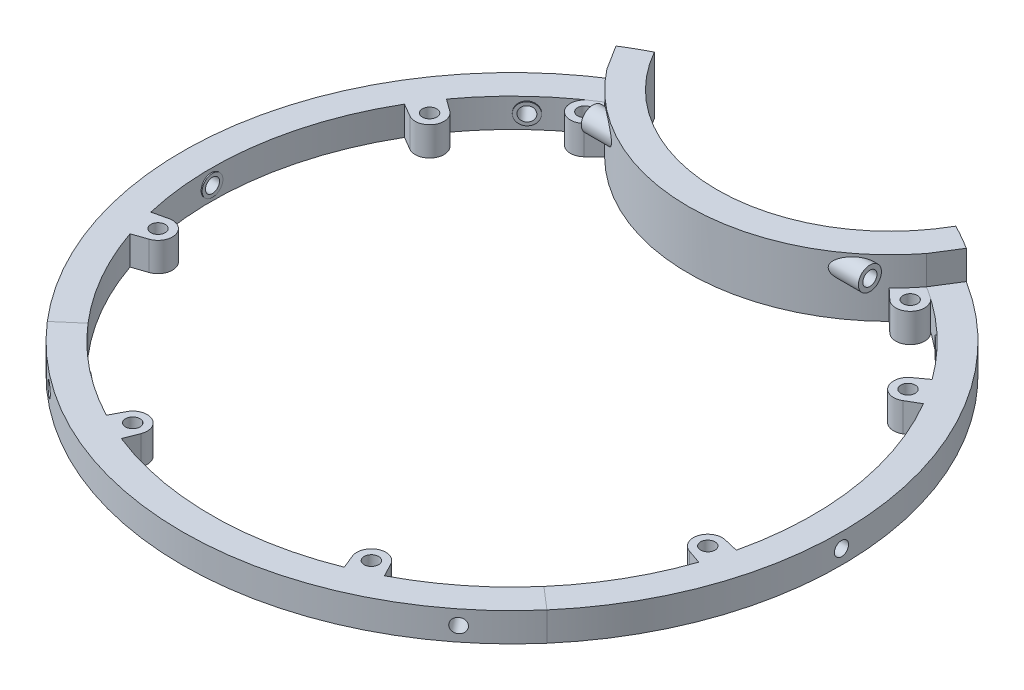
from build123d import *
from build123d.topology import SkipClean

# Parameters (mm, degrees)
BOSS_EXTRUDE1_DEPTH                 = 12.7
CUT_EXTRUDE2_REACH                  = 78.175
CUT_EXTRUDE2_END_RADIUS             = 44.45
SKETCH9_R                           = 1.55
BOSS_EXTRUDE3_START                 = -22.86
SKETCH9_3_R                         = 2.54
SKETCH9_3_R_2                       = 1.55
BOSS_EXTRUDE3_DEPTH                 = 7.62
BOSS_EXTRUDE4_DEPTH                 = 6.35
SKETCH10_R                          = 3.175
SKETCH10_R_2                        = 1.5875
BOSS_EXTRUDE5_DEPTH                 = 6.35
CIRPATTERN3_COUNT                   = 2
CIRPATTERN3_ANGLE                   = 98.596666667
CUT_EXTRUDE3_REACH                  = 159.445
CUT_EXTRUDE3_END_RADIUS             = 72.5
SKETCH12_R                          = 1.55
CUT_EXTRUDE3_DIRECTION_2_REACH      = 159.445
CUT_EXTRUDE3_DIRECTION_2_END_RADIUS = 66.15
SKETCH12_4_R                        = 2.286
SKETCH12_4_R_2                      = 1.55
BOSS_EXTRUDE6_DEPTH                 = 0.254
CUT_EXTRUDE4_REACH                  = 143.725
CUT_EXTRUDE4_END_RADIUS             = 72.5
SKETCH13_R                          = 1.55
CUT_EXTRUDE4_DIRECTION_2_REACH      = 143.725
CUT_EXTRUDE4_DIRECTION_2_END_RADIUS = 66.15
SKETCH13_6_R                        = 2.286
SKETCH13_6_R_2                      = 1.55
BOSS_EXTRUDE7_DEPTH                 = 0.254
CUT_EXTRUDE5_REACH                  = 153.381
CUT_EXTRUDE5_END_RADIUS             = 72.5
SKETCH14_R                          = 1.55
CUT_EXTRUDE5_DIRECTION_2_REACH      = 153.381
CUT_EXTRUDE5_DIRECTION_2_END_RADIUS = 66.15
SKETCH14_8_R                        = 2.286
SKETCH14_8_R_2                      = 1.55
BOSS_EXTRUDE8_DEPTH                 = 0.254
SKETCH15_R                          = 3.175
SKETCH15_R_2                        = 1.5875
BOSS_EXTRUDE9_DEPTH                 = 6.35


with BuildPart() as part:
    # Sketch1 → Boss-Extrude1 (new body)
    with BuildSketch(Plane(origin=(0, 0, 0), x_dir=(1, 0, 0), z_dir=(0, 1, 0))):
        with BuildLine():
            Line((35.15688403, 56.034061117), (38.531732308, 61.412992154))
            ThreePointArc((38.531732308, 61.412992154), (35.878756385, 62.999720954), (33.160552015, 64.471914738))
            ThreePointArc((33.160552015, 64.471914738), (0, 45.133252378), (-33.160552015, 64.471914738))
            ThreePointArc((-33.160552015, 64.471914738), (-35.878756385, 62.999720954), (-38.531732308, 61.412992154))
            Line((-38.531732308, 61.412992154), (-35.15688403, 56.034061117))
            ThreePointArc((-35.15688403, 56.034061117), (0, 38.783252378), (35.15688403, 56.034061117))
        make_face()
    extrude(amount=BOSS_EXTRUDE1_DEPTH)

    # Cut-Extrude2: up to this cylinder (the profile starts inside it)
    cut_extrude2_end = Plane(origin=(0, 9.525, -83.233252378), z_dir=(0, -1, 0)) * Cylinder(CUT_EXTRUDE2_END_RADIUS, 246.25, mode=Mode.PRIVATE)
    # Sketch9 → Cut-Extrude2 (cut, up to the surface)
    with BuildSketch(Plane(origin=(0, 0, 0), x_dir=(0, 0, -1), z_dir=(1, 0, 0)), mode=Mode.PRIVATE) as cut_extrude2_sk1:
        with Locations((48.26, 9.525)):
            Circle(SKETCH9_R)
    cut_extrude2_tool1 = extrude(cut_extrude2_sk1.sketch, amount=-CUT_EXTRUDE2_REACH, mode=Mode.PRIVATE) & cut_extrude2_end
    cut_extrude2 = cut_extrude2_tool1.solids().sort_by_distance((0, 9.525, -48.26))[0]
    add(cut_extrude2, mode=Mode.SUBTRACT)

    # Sketch9<3> → Boss-Extrude3 (add)
    with BuildSketch(Plane(origin=(0, 0, 0), x_dir=(0, 0, -1), z_dir=(1, 0, 0)).offset(BOSS_EXTRUDE3_START)):
        with Locations((48.26, 9.525)):
            Circle(SKETCH9_3_R)
        with Locations((48.26, 9.525)):
            Circle(SKETCH9_3_R_2, mode=Mode.SUBTRACT)
    boss_extrude3 = extrude(amount=-BOSS_EXTRUDE3_DEPTH)

    # Mirror1: Cut-Extrude2, Boss-Extrude3 across plane
    add(cut_extrude2.mirror(Plane(origin=(0, 0, 0), x_dir=(0, 0, 1), z_dir=(1, 0, 0))), mode=Mode.SUBTRACT)
    add(boss_extrude3.mirror(Plane(origin=(0, 0, 0), x_dir=(0, 0, 1), z_dir=(1, 0, 0))))

    # Sketch15 → Boss-Extrude9 (add)
    # profile 1 of 3: a face of its own
    with BuildSketch(Plane(origin=(0, 0, 0), x_dir=(1, 0, 0), z_dir=(0, 1, 0))):
        with BuildLine():
            ThreePointArc((-37.5961556, 54.427489232), (-35.402295533, 54.966169873), (-33.405543548, 53.909675511))
            ThreePointArc((-33.405543548, 53.909675511), (-34.297665699, 54.958305383), (-35.15688403, 56.034061117))
            ThreePointArc((-35.15688403, 56.034061117), (-36.385388031, 55.244239861), (-37.5961556, 54.427489232))
        make_face()
    # profile 2 of 3: a face of its own
    with BuildSketch(Plane(origin=(0, 0, 0), x_dir=(1, 0, 0), z_dir=(0, 1, 0))):
        with Locations((-35.791653801, 51.815134306)):
            Circle(SKETCH15_R)
        with Locations(Location((-35.791653801, 51.815134306, 0), (0, 0, 270))):
            Circle(SKETCH15_R_2, mode=Mode.SUBTRACT)
    # profile 3 of 3: a face of its own
    with BuildSketch(Plane(origin=(0, 0, 0), x_dir=(1, 0, 0), z_dir=(0, 1, 0))):
        with BuildLine():
            Line((-33.616078571, 49.502668649), (-31.304988153, 51.676950048))
            ThreePointArc((-31.304988153, 51.676950048), (-32.374519209, 52.775199158), (-33.405543548, 53.909675511))
            ThreePointArc((-33.405543548, 53.909675511), (-32.820414577, 52.934224326), (-32.616653801, 51.815134306))
            ThreePointArc((-32.616653801, 51.815134306), (-32.877200477, 50.555536425), (-33.616078571, 49.502668649))
        make_face()
    boss_extrude9 = extrude(amount=BOSS_EXTRUDE9_DEPTH)

    # Mirror13: Boss-Extrude9 across plane
    add(boss_extrude9.mirror(Plane(origin=(0, 0, 0), x_dir=(0, 0, 1), z_dir=(1, 0, 0))))


with BuildPart() as body_2:
    # Sketch1<4> → Boss-Extrude4 (new body)
    with BuildSketch(Plane(origin=(0, 0, 0), x_dir=(1, 0, 0), z_dir=(0, 1, 0))):
        with BuildLine():
            ThreePointArc((72.5, 0), (63.442101921, 35.090592811), (38.531732308, 61.412992154))
            Line((38.531732308, 61.412992154), (35.15688403, 56.034061117))
            ThreePointArc((35.15688403, 56.034061117), (65.406807383, 9.887974916), (50.149337188, -43.137761644))
            Line((50.149337188, -43.137761644), (54.963370311, -47.278725914))
            ThreePointArc((54.963370311, -47.278725914), (67.974606831, -25.213147884), (72.5, 0))
        make_face()
    extrude(amount=BOSS_EXTRUDE4_DEPTH)

    # Sketch10 → Boss-Extrude5 (add)
    # profile 1 of 4: a face of its own
    with BuildSketch(Plane(origin=(0, 6.35, 0), x_dir=(1, 0, 0), z_dir=(0, 1, 0))):
        with BuildLine():
            Line((53.422736064, 39.010687913), (50.756041061, 37.063397036))
            ThreePointArc((50.756041061, 37.063397036), (54.066450502, 37.329945532), (55.803436134, 34.499267225))
            ThreePointArc((55.803436134, 34.499267225), (55.382955089, 32.920264271), (54.232884745, 31.75949175))
            Line((54.232884745, 31.75949175), (57.082251239, 33.428118305))
            ThreePointArc((57.082251239, 33.428118305), (55.32295478, 36.265592156), (53.422736064, 39.010687913))
        make_face()
    # profile 2 of 4: a face of its own
    with BuildSketch(Plane(origin=(0, 6.35, 0), x_dir=(1, 0, 0), z_dir=(0, 1, 0))):
        with Locations((52.628436134, 34.499267225)):
            Circle(SKETCH10_R)
        with Locations(Location((52.628436134, 34.499267225, 0), (0, 0, 270))):
            Circle(SKETCH10_R_2, mode=Mode.SUBTRACT)
    # profile 3 of 4: a face of its own
    with BuildSketch(Plane(origin=(0, 6.35, 0), x_dir=(1, 0, 0), z_dir=(0, 1, 0))):
        with Locations((60.474502168, -17.400756204)):
            Circle(SKETCH10_R)
        with Locations(Location((60.474502168, -17.400756204, 0), (0, 0, 270))):
            Circle(SKETCH10_R_2, mode=Mode.SUBTRACT)
    # profile 4 of 4: a face of its own
    with BuildSketch(Plane(origin=(0, 6.35, 0), x_dir=(1, 0, 0), z_dir=(0, 1, 0))):
        with BuildLine():
            ThreePointArc((62.566871119, -21.475780275), (63.570730855, -18.291655982), (64.412659059, -15.060937984))
            Line((64.412659059, -15.060937984), (61.197381656, -14.309143317))
            ThreePointArc((61.197381656, -14.309143317), (62.962047884, -15.427753084), (63.649502168, -17.400756204))
            ThreePointArc((63.649502168, -17.400756204), (62.319484857, -19.984680328), (59.443729646, -20.403776851))
            Line((59.443729646, -20.403776851), (62.566871119, -21.475780275))
        make_face()
    extrude(amount=-BOSS_EXTRUDE5_DEPTH)


with BuildPart() as cirpattern3_1:
    # CirPattern3: pattern copy
    add(body_2.part.rotate(Axis((0, 0, 0), (0, -1, 0)), 1 * CIRPATTERN3_ANGLE / (CIRPATTERN3_COUNT - 1)))

    # Cut-Extrude5: up to this cylinder (the profile starts inside it)
    cut_extrude5_end = Plane(origin=(0, 3.175, 0), z_dir=(0, -1, 0)) * Cylinder(CUT_EXTRUDE5_END_RADIUS, 452.762, mode=Mode.PRIVATE)
    # Sketch14 → Cut-Extrude5 (cut, up to the surface)
    with BuildSketch(Plane(origin=(41.106834506, 0, 51.827122792), x_dir=(-0.7834788026054743, 0, 0.621418511043799), z_dir=(-0.621418511043799, 0, -0.7834788026054743)), mode=Mode.PRIVATE) as cut_extrude5_sk1:
        with Locations((0, 3.175)):
            Circle(SKETCH14_R)
    cut_extrude5_tool1 = extrude(cut_extrude5_sk1.sketch, amount=-CUT_EXTRUDE5_REACH, mode=Mode.PRIVATE) & cut_extrude5_end
    cut_extrude5 = cut_extrude5_tool1.solids().sort_by_distance((41.106835, 3.175, 51.827123))[0]
    add(cut_extrude5, mode=Mode.SUBTRACT)

    # Cut-Extrude5 direction 2: up to this cylinder (the profile starts outside it)
    with SkipClean():  # the faces are left unmerged after this step: merging them gives an invalid solid
        cut_extrude5_direction_2_end = Plane(origin=(0, 3.175, 0), z_dir=(0, -1, 0)) * Cylinder(CUT_EXTRUDE5_DIRECTION_2_END_RADIUS, 440.062, mode=Mode.PRIVATE)
        # Sketch14 → Cut-Extrude5 direction 2 (cut, up to the surface)
        with BuildSketch(Plane(origin=(41.106834506, 0, 51.827122792), x_dir=(-0.7834788026054743, 0, 0.621418511043799), z_dir=(-0.621418511043799, 0, -0.7834788026054743)), mode=Mode.PRIVATE) as cut_extrude5_direction_2_sk1:
            with Locations((0, 3.175)):
                Circle(SKETCH14_R)
        cut_extrude5_direction_2_tool1 = extrude(cut_extrude5_direction_2_sk1.sketch, amount=CUT_EXTRUDE5_DIRECTION_2_REACH, mode=Mode.PRIVATE) - cut_extrude5_direction_2_end
        cut_extrude5_direction_2 = cut_extrude5_direction_2_tool1.solids().sort_by_distance((41.106835, 3.175, 51.827123))[0] + cut_extrude5_direction_2_tool1.solids().sort_by_distance((41.106835, 3.175, 51.827123))[1]
        add(cut_extrude5_direction_2, mode=Mode.SUBTRACT)
        cut_extrude5 = cut_extrude5 + cut_extrude5_direction_2  # both directions under the feature's name, for the pattern or mirror that repeats it

    # Sketch14<8> → Boss-Extrude8 (add)
    with BuildSketch(Plane(origin=(41.106834506, 0, 51.827122792), x_dir=(-0.7834788026054743, 0, 0.621418511043799), z_dir=(-0.621418511043799, 0, -0.7834788026054743))):
        with Locations(Location((0, 3.175, 0), (0, 0, 180))):
            Circle(SKETCH14_8_R)
        with Locations((0, 3.175)):
            Circle(SKETCH14_8_R_2, mode=Mode.SUBTRACT)
    boss_extrude8 = extrude(amount=BOSS_EXTRUDE8_DEPTH)

    # Mirror12: Cut-Extrude5, Boss-Extrude8 across plane
    add(cut_extrude5.mirror(Plane(origin=(0, 0, 0), x_dir=(0, 0, 1), z_dir=(1, 0, 0))), mode=Mode.SUBTRACT)
    add(boss_extrude8.mirror(Plane(origin=(0, 0, 0), x_dir=(0, 0, 1), z_dir=(1, 0, 0))))


with BuildPart() as body_2_1:
    add(body_2.part)

    # Cut-Extrude3: up to this cylinder (the profile starts inside it)
    cut_extrude3_end = Plane(origin=(0, 3.175, 0), z_dir=(0, -1, 0)) * Cylinder(CUT_EXTRUDE3_END_RADIUS, 464.89, mode=Mode.PRIVATE)
    # Sketch12 → Cut-Extrude3 (cut, up to the surface)
    with BuildSketch(Plane(origin=(45.100289166, 0, -48.392007782), x_dir=(0.7315496263323975, 0, 0.6817881960058634), z_dir=(-0.6817881960058634, 0, 0.7315496263323975)), mode=Mode.PRIVATE) as cut_extrude3_sk1:
        with Locations((0, 3.175)):
            Circle(SKETCH12_R)
    cut_extrude3_tool1 = extrude(cut_extrude3_sk1.sketch, amount=-CUT_EXTRUDE3_REACH, mode=Mode.PRIVATE) & cut_extrude3_end
    add(cut_extrude3_tool1.solids().sort_by_distance((45.100289, 3.175, -48.392008))[0], mode=Mode.SUBTRACT)

    # Cut-Extrude3 direction 2: up to this cylinder (the profile starts outside it)
    with SkipClean():  # the faces are left unmerged after this step: merging them gives an invalid solid
        cut_extrude3_direction_2_end = Plane(origin=(0, 3.175, 0), z_dir=(0, -1, 0)) * Cylinder(CUT_EXTRUDE3_DIRECTION_2_END_RADIUS, 452.19, mode=Mode.PRIVATE)
        # Sketch12 → Cut-Extrude3 direction 2 (cut, up to the surface)
        with BuildSketch(Plane(origin=(45.100289166, 0, -48.392007782), x_dir=(0.7315496263323975, 0, 0.6817881960058634), z_dir=(-0.6817881960058634, 0, 0.7315496263323975)), mode=Mode.PRIVATE) as cut_extrude3_direction_2_sk1:
            with Locations((0, 3.175)):
                Circle(SKETCH12_R)
        cut_extrude3_direction_2_tool1 = extrude(cut_extrude3_direction_2_sk1.sketch, amount=CUT_EXTRUDE3_DIRECTION_2_REACH, mode=Mode.PRIVATE) - cut_extrude3_direction_2_end
        add(cut_extrude3_direction_2_tool1.solids().sort_by_distance((45.100289, 3.175, -48.392008))[0], mode=Mode.SUBTRACT)
        add(cut_extrude3_direction_2_tool1.solids().sort_by_distance((45.100289, 3.175, -48.392008))[1], mode=Mode.SUBTRACT)

    # Sketch12<4> → Boss-Extrude6 (add)
    with BuildSketch(Plane(origin=(45.100289166, 0, -48.392007782), x_dir=(0.7315496263323975, 0, 0.6817881960058634), z_dir=(-0.6817881960058634, 0, 0.7315496263323975))):
        with Locations(Location((0, 3.175, 0), (0, 0, 180))):
            Circle(SKETCH12_4_R)
        with Locations((0, 3.175)):
            Circle(SKETCH12_4_R_2, mode=Mode.SUBTRACT)
    extrude(amount=BOSS_EXTRUDE6_DEPTH)

    # Cut-Extrude4: up to this cylinder (the profile starts inside it)
    cut_extrude4_end = Plane(origin=(0, 3.175, 0), z_dir=(0, -1, 0)) * Cylinder(CUT_EXTRUDE4_END_RADIUS, 433.45, mode=Mode.PRIVATE)
    # Sketch13 → Cut-Extrude4 (cut, up to the surface)
    with BuildSketch(Plane.ZY.offset(-66.15), mode=Mode.PRIVATE) as cut_extrude4_sk1:
        with Locations(Location((0, 3.175, 0), (0, 0, 270))):
            Circle(SKETCH13_R)
    cut_extrude4_tool1 = extrude(cut_extrude4_sk1.sketch, amount=-CUT_EXTRUDE4_REACH, mode=Mode.PRIVATE) & cut_extrude4_end
    add(cut_extrude4_tool1.solids().sort_by_distance((66.15, 3.175, 0))[0], mode=Mode.SUBTRACT)

    # Cut-Extrude4 direction 2: up to this cylinder (the profile starts outside it)
    cut_extrude4_direction_2_end = Plane(origin=(0, 3.175, 0), z_dir=(0, -1, 0)) * Cylinder(CUT_EXTRUDE4_DIRECTION_2_END_RADIUS, 420.75, mode=Mode.PRIVATE)
    # Sketch13 → Cut-Extrude4 direction 2 (cut, up to the surface)
    with BuildSketch(Plane.ZY.offset(-66.15), mode=Mode.PRIVATE) as cut_extrude4_direction_2_sk1:
        with Locations(Location((0, 3.175, 0), (0, 0, 270))):
            Circle(SKETCH13_R)
    cut_extrude4_direction_2_tool1 = extrude(cut_extrude4_direction_2_sk1.sketch, amount=CUT_EXTRUDE4_DIRECTION_2_REACH, mode=Mode.PRIVATE) - cut_extrude4_direction_2_end
    add(cut_extrude4_direction_2_tool1.solids().sort_by_distance((66.15, 3.175, 0))[0], mode=Mode.SUBTRACT)
    add(cut_extrude4_direction_2_tool1.solids().sort_by_distance((66.15, 3.175, 0))[1], mode=Mode.SUBTRACT)

    # Sketch13<6> → Boss-Extrude7 (add)
    with BuildSketch(Plane.ZY.offset(-66.15)):
        with Locations(Location((0, 3.175, 0), (0, 0, 180))):
            Circle(SKETCH13_6_R)
        with Locations((0, 3.175)):
            Circle(SKETCH13_6_R_2, mode=Mode.SUBTRACT)
    extrude(amount=BOSS_EXTRUDE7_DEPTH)


with BuildPart() as body_4:
    # Mirror11: mirrored copy
    add(body_2_1.part.mirror(Plane(origin=(0, 0, 0), x_dir=(0, 0, 1), z_dir=(1, 0, 0))))


solid = Compound([part.part, cirpattern3_1.part, body_2_1.part, body_4.part])
